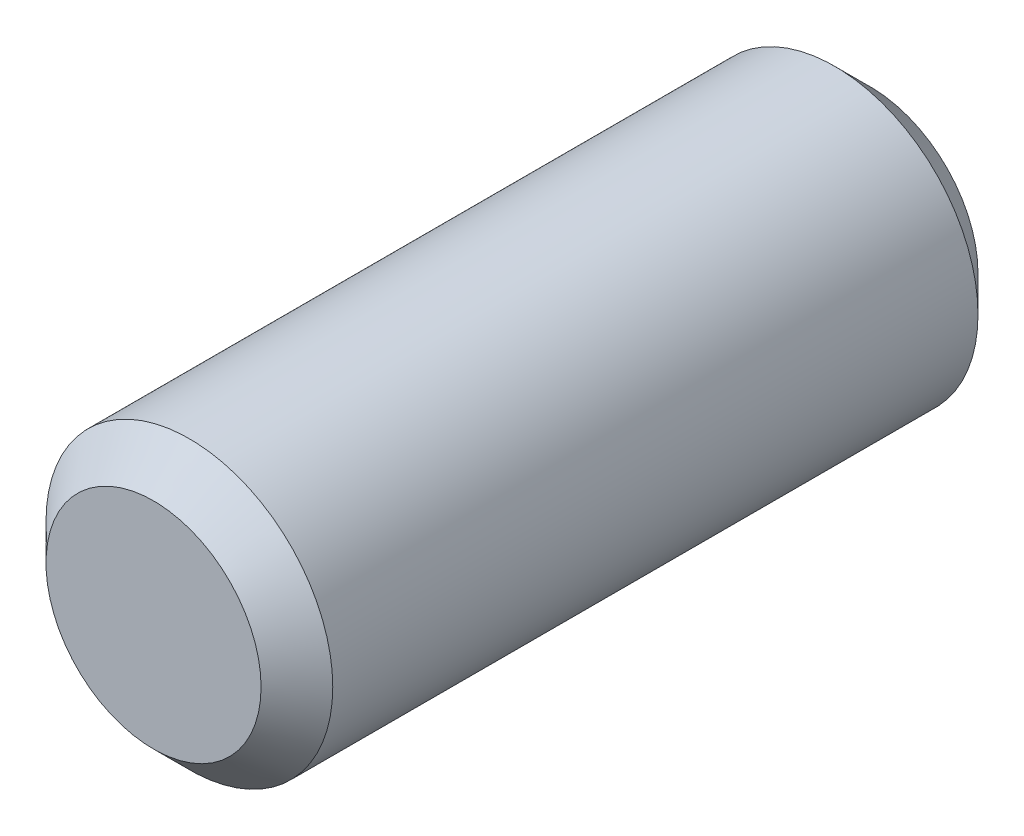
from build123d import *

# Parameters (mm, degrees)
ESBO_O1_R                = 4
RESSALTO_EXTRUS_O1_DEPTH = 20
CHANFRO1_SIZE            = 1


with BuildPart() as part:
    # Esboço1 → Ressalto-extrusão1 (new body)
    with BuildSketch(Plane.XY):
        with Locations((208.88140452, 179.873872767)):
            Circle(ESBO_O1_R)
    extrude(amount=-RESSALTO_EXTRUS_O1_DEPTH)

    # Chanfro1
    chanfro1_edges = [part.edges().sort_by_distance(p)[0] for p in [
        (204.88140452, 179.873872767, 0),
        (204.88140452, 179.873872767, -20),
    ]]
    chamfer(chanfro1_edges, length=CHANFRO1_SIZE)


solid = part.part
